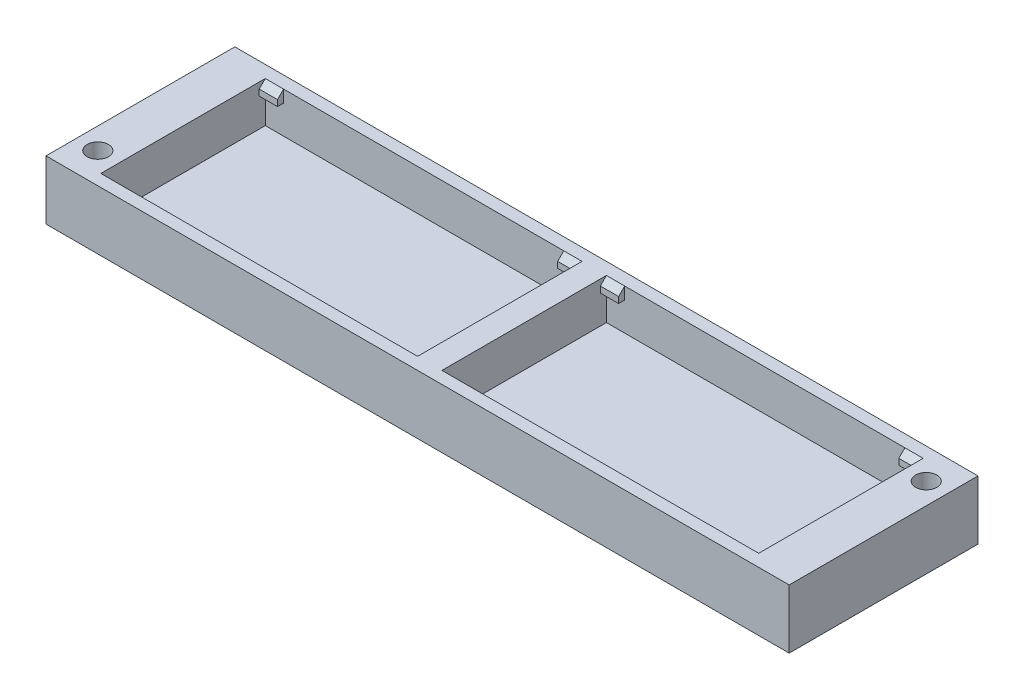
from build123d import *

# Parameters (mm, degrees)
SKETCH1_W           = 122
SKETCH1_H           = 31
BOSS_EXTRUDE1_DEPTH = 9.7
SKETCH3_W           = 52
SKETCH3_H           = 27
CUT_EXTRUDE2_DEPTH  = 6.7
SKETCH4_W           = 3
SKETCH4_H           = 3
BOSS_EXTRUDE2_DEPTH = 2
CHAMFER1_SIZE       = 1
SKETCH5_R           = 1.75
CUT_EXTRUDE3_DEPTH  = 64.681551489


with BuildPart() as part:
    # Sketch1 → Boss-Extrude1 (new body)
    with BuildSketch(Plane(origin=(0, 0, 0), x_dir=(1, 0, 0), z_dir=(0, 1, 0))):
        Rectangle(SKETCH1_W, SKETCH1_H)
    extrude(amount=BOSS_EXTRUDE1_DEPTH)

    # Sketch3 → Cut-Extrude2 (cut)
    with BuildSketch(Plane(origin=(0, 9.7, 0), x_dir=(1, 0, 0), z_dir=(0, 1, 0))):
        with Locations((-28, 0)):
            Rectangle(SKETCH3_W, SKETCH3_H)
        with Locations((28, 0)):
            Rectangle(SKETCH3_W, SKETCH3_H)
    extrude(amount=-CUT_EXTRUDE2_DEPTH, mode=Mode.SUBTRACT)

    # Sketch4 → Boss-Extrude2 (add)
    with BuildSketch(Plane(origin=(0, 9.7, 0), x_dir=(1, 0, 0), z_dir=(0, 1, 0))):
        with Locations((-52.5, 14)):
            Rectangle(SKETCH4_W, SKETCH4_H)
        with Locations((-3.5, 14)):
            Rectangle(SKETCH4_W, SKETCH4_H)
        with Locations((-3.5, -14)):
            Rectangle(SKETCH4_W, SKETCH4_H)
        with Locations((-52.5, -14)):
            Rectangle(SKETCH4_W, SKETCH4_H)
        with Locations((52.5, -14)):
            Rectangle(SKETCH4_W, SKETCH4_H)
        with Locations((3.5, -14)):
            Rectangle(SKETCH4_W, SKETCH4_H)
        with Locations((3.5, 14)):
            Rectangle(SKETCH4_W, SKETCH4_H)
        with Locations((52.5, 14)):
            Rectangle(SKETCH4_W, SKETCH4_H)
    extrude(amount=-BOSS_EXTRUDE2_DEPTH)

    # Chamfer1
    chamfer1_edges = [part.edges().sort_by_distance(p)[0] for p in [
        (-52.5, 9.7, 12.5),
        (-3.5, 9.7, 12.5),
        (52.5, 9.7, 12.5),
        (3.5, 9.7, 12.5),
        (52.5, 9.7, -12.5),
        (3.5, 9.7, -12.5),
        (-3.5, 9.7, -12.5),
        (-52.5, 9.7, -12.5),
    ]]
    chamfer(chamfer1_edges, length=CHAMFER1_SIZE)

    # Sketch5 → Cut-Extrude3 (cut, through all)
    with BuildSketch(Plane(origin=(0, 9.7, 0), x_dir=(1, 0, 0), z_dir=(0, 1, 0))):
        with Locations(Location((-57.5, -10.5, 0), (0, 0, 270))):
            Circle(SKETCH5_R)
        with Locations(Location((57.5, 10.5, 0), (0, 0, 270))):
            Circle(SKETCH5_R)
    extrude(amount=-CUT_EXTRUDE3_DEPTH, mode=Mode.SUBTRACT)


solid = part.part
